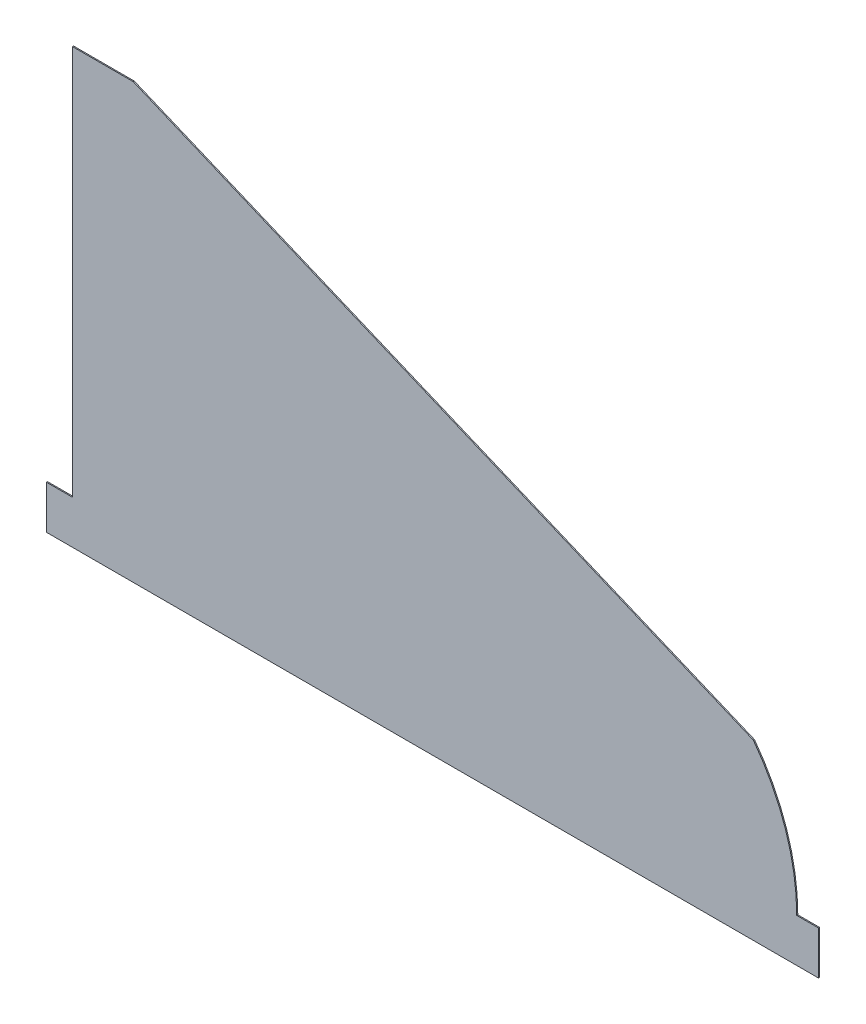
from build123d import *

# Parameters (mm, degrees)
BOSS_EXTRUDE1_DEPTH = 0.125
SKETCH2_W           = 1
SKETCH2_H           = 90
CUT_EXTRUDE1_DEPTH  = 200.822577553


with BuildPart() as part:
    # Sketch1 → Boss-Extrude1 (new, symmetric)
    with BuildSketch(Plane.XY):
        with BuildLine():
            Line((0, 0), (168, 0))
            Line((168, 0), (173, 0))
            Line((173, 0), (173, 10))
            Line((173, 10), (168, 10))
            ThreePointArc((168, 10), (165.434164903, 25.811388301), (158, 40))
            Line((158, 40), (15, 100))
            Line((15, 100), (0, 100))
            Line((0, 100), (0, 10))
            Line((0, 10), (-5, 10))
            Line((-5, 10), (-5, 0))
            Line((-5, 0), (0, 0))
        make_face()
    extrude(amount=BOSS_EXTRUDE1_DEPTH, both=True)

    # Sketch2 → Cut-Extrude1 (cut, through all)
    with BuildSketch(Plane.XY.offset(0.125)):
        with Locations((0.5, 55)):
            Rectangle(SKETCH2_W, SKETCH2_H)
    extrude(amount=-CUT_EXTRUDE1_DEPTH, mode=Mode.SUBTRACT)


solid = part.part
